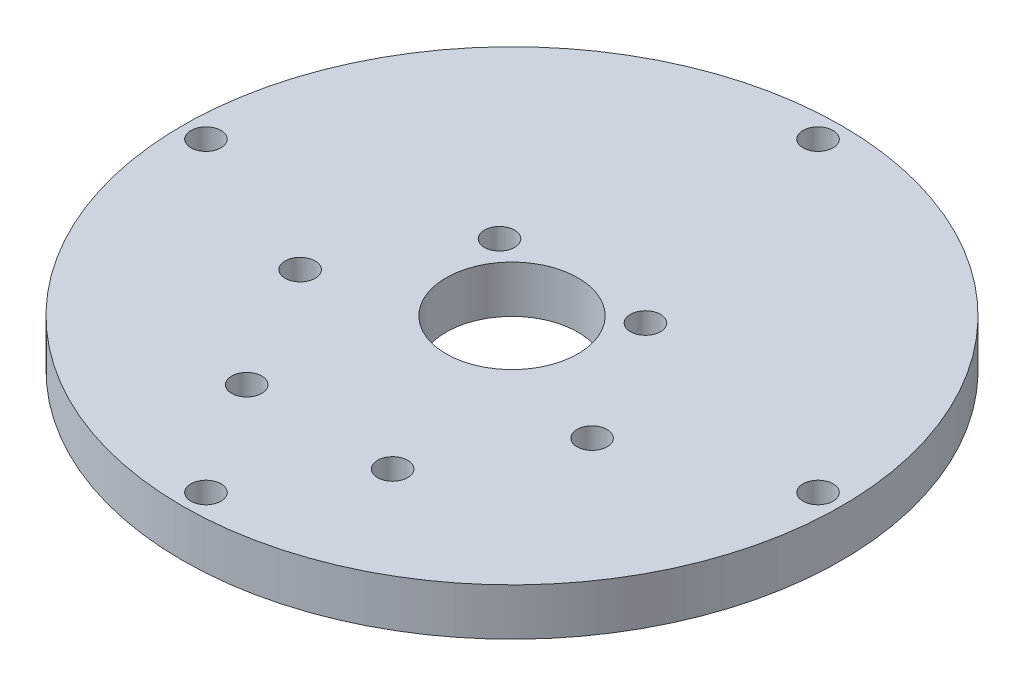
from build123d import *

# Parameters (mm, degrees)
SKETCH_1_R          = 35
EXTRUDE_1_DEPTH     = 5
SKETCH_3_R          = 1.6
CUT_EXTRUDE_1_DEPTH = 50.749371855
SKETCH_4_R          = 7
SKETCH_4_R_2        = 1.6
CUT_EXTRUDE_2_DEPTH = 50.749371855


with BuildPart() as part:
    # ｽｹｯﾁ1 → ﾎﾞｽ - 押し出し1 (new body)
    with BuildSketch(Plane(origin=(0, 0, 0), x_dir=(1, 0, 0), z_dir=(0, 1, 0))):
        with Locations(Location((0, 0, 0), (0, 0, 270))):
            Circle(SKETCH_1_R)
    extrude(amount=EXTRUDE_1_DEPTH)

    # ｽｹｯﾁ3 → ｶｯﾄ - 押し出し1 (cut, through all)
    with BuildSketch(Plane(origin=(0, 5, 0), x_dir=(1, 0, 0), z_dir=(0, 1, 0))):
        with Locations(Location((-32.5, 0, 0), (0, 0, 270))):
            Circle(SKETCH_3_R)
        with Locations(Location((0, 32.5, 0), (0, 0, 270))):
            Circle(SKETCH_3_R)
        with Locations(Location((32.5, 0, 0), (0, 0, 270))):
            Circle(SKETCH_3_R)
        with Locations(Location((0, -32.5, 0), (0, 0, 270))):
            Circle(SKETCH_3_R)
    extrude(amount=-CUT_EXTRUDE_1_DEPTH, mode=Mode.SUBTRACT)

    # ｽｹｯﾁ4 → ｶｯﾄ - 押し出し2 (cut, through all)
    with BuildSketch(Plane(origin=(0, 5, 0), x_dir=(1, 0, 0), z_dir=(0, 1, 0))):
        with Locations(Location((0, 0, 0), (0, 0, 270))):
            Circle(SKETCH_4_R)
        with Locations(Location((-15.5, -7, 0), (0, 0, 270))):
            Circle(SKETCH_4_R_2)
        with Locations(Location((-7.75, 6.423393759, 0), (0, 0, 270))):
            Circle(SKETCH_4_R_2)
        with Locations(Location((7.75, 6.423393759, 0), (0, 0, 270))):
            Circle(SKETCH_4_R_2)
        with Locations(Location((15.5, -7, 0), (0, 0, 270))):
            Circle(SKETCH_4_R_2)
        with Locations(Location((7.75, -20.423393759, 0), (0, 0, 270))):
            Circle(SKETCH_4_R_2)
        with Locations(Location((-7.75, -20.423393759, 0), (0, 0, 270))):
            Circle(SKETCH_4_R_2)
    extrude(amount=-CUT_EXTRUDE_2_DEPTH, mode=Mode.SUBTRACT)


solid = part.part
